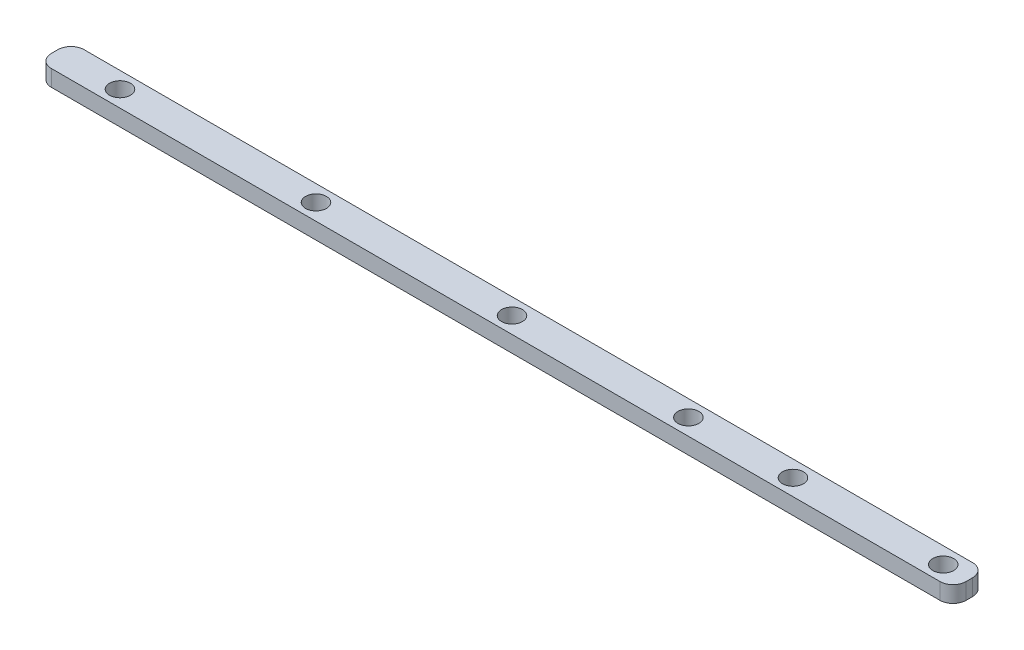
from build123d import *

# Parameters (mm, degrees)
SKETCH1_W           = 177.8
SKETCH1_H           = 6.35
BOSS_EXTRUDE1_DEPTH = 3.175
FILLET1_R           = 2.54
CUT_EXTRUDE1_REACH  = 91.013
SKETCH2_R           = 2.032


with BuildPart() as part:
    # Sketch1 → Boss-Extrude1 (new body)
    with BuildSketch(Plane(origin=(0, 0, 0), x_dir=(1, 0, 0), z_dir=(0, 1, 0))):
        Rectangle(SKETCH1_W, SKETCH1_H)
    extrude(amount=BOSS_EXTRUDE1_DEPTH)

    # Fillet1
    fillet1_edges = [part.edges().sort_by_distance(p)[0] for p in [
        (-88.9, 1.5875, 3.175),
        (-88.9, 1.5875, -3.175),
        (88.9, 1.5875, -3.175),
        (88.9, 1.5875, 3.175),
    ]]
    fillet(fillet1_edges, radius=FILLET1_R)

    # Sketch2 → Cut-Extrude1 (cut, up to next)
    with BuildSketch(Plane(origin=(0, 3.175, 0), x_dir=(1, 0, 0), z_dir=(0, 1, 0)), mode=Mode.PRIVATE) as cut_extrude1_sk1:
        with Locations(Location((-76.2, 0, 0), (0, 0, 270))):
            Circle(SKETCH2_R)
    cut_extrude1_tool1 = extrude(cut_extrude1_sk1.sketch, amount=-CUT_EXTRUDE1_REACH, mode=Mode.PRIVATE) & part.part
    # Sketch2 → Cut-Extrude1 (cut, up to next)
    with BuildSketch(Plane(origin=(0, 3.175, 0), x_dir=(1, 0, 0), z_dir=(0, 1, 0)), mode=Mode.PRIVATE) as cut_extrude1_sk2:
        with Locations(Location((0, 0, 0), (0, 0, 270))):
            Circle(SKETCH2_R)
    cut_extrude1_tool2 = extrude(cut_extrude1_sk2.sketch, amount=-CUT_EXTRUDE1_REACH, mode=Mode.PRIVATE) & part.part
    # Sketch2 → Cut-Extrude1 (cut, up to next)
    with BuildSketch(Plane(origin=(0, 3.175, 0), x_dir=(1, 0, 0), z_dir=(0, 1, 0)), mode=Mode.PRIVATE) as cut_extrude1_sk3:
        with Locations(Location((-38.1, 0, 0), (0, 0, 270))):
            Circle(SKETCH2_R)
    cut_extrude1_tool3 = extrude(cut_extrude1_sk3.sketch, amount=-CUT_EXTRUDE1_REACH, mode=Mode.PRIVATE) & part.part
    # Sketch2 → Cut-Extrude1 (cut, up to next)
    with BuildSketch(Plane(origin=(0, 3.175, 0), x_dir=(1, 0, 0), z_dir=(0, 1, 0)), mode=Mode.PRIVATE) as cut_extrude1_sk4:
        with Locations(Location((83.82, 0, 0), (0, 0, 270))):
            Circle(SKETCH2_R)
    cut_extrude1_tool4 = extrude(cut_extrude1_sk4.sketch, amount=-CUT_EXTRUDE1_REACH, mode=Mode.PRIVATE) & part.part
    # Sketch2 → Cut-Extrude1 (cut, up to next)
    with BuildSketch(Plane(origin=(0, 3.175, 0), x_dir=(1, 0, 0), z_dir=(0, 1, 0)), mode=Mode.PRIVATE) as cut_extrude1_sk5:
        with Locations(Location((54.61, 0, 0), (0, 0, 270))):
            Circle(SKETCH2_R)
    cut_extrude1_tool5 = extrude(cut_extrude1_sk5.sketch, amount=-CUT_EXTRUDE1_REACH, mode=Mode.PRIVATE) & part.part
    # Sketch2 → Cut-Extrude1 (cut, up to next)
    with BuildSketch(Plane(origin=(0, 3.175, 0), x_dir=(1, 0, 0), z_dir=(0, 1, 0)), mode=Mode.PRIVATE) as cut_extrude1_sk6:
        with Locations(Location((34.29, 0, 0), (0, 0, 270))):
            Circle(SKETCH2_R)
    cut_extrude1_tool6 = extrude(cut_extrude1_sk6.sketch, amount=-CUT_EXTRUDE1_REACH, mode=Mode.PRIVATE) & part.part
    add(cut_extrude1_tool1.solids().sort_by_distance((-76.2, 3.175, 0))[0], mode=Mode.SUBTRACT)
    add(cut_extrude1_tool2.solids().sort_by_distance((0, 3.175, 0))[0], mode=Mode.SUBTRACT)
    add(cut_extrude1_tool3.solids().sort_by_distance((-38.1, 3.175, 0))[0], mode=Mode.SUBTRACT)
    add(cut_extrude1_tool4.solids().sort_by_distance((83.82, 3.175, 0))[0], mode=Mode.SUBTRACT)
    add(cut_extrude1_tool5.solids().sort_by_distance((54.61, 3.175, 0))[0], mode=Mode.SUBTRACT)
    add(cut_extrude1_tool6.solids().sort_by_distance((34.29, 3.175, 0))[0], mode=Mode.SUBTRACT)


solid = part.part
